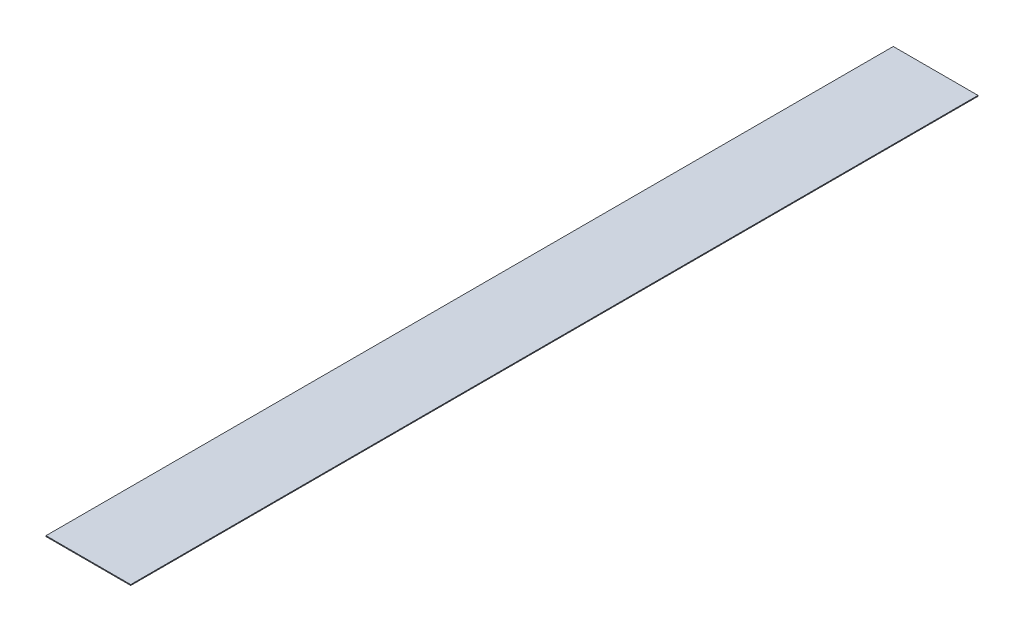
from build123d import *

# Parameters (mm, degrees)
SKETCH1_W           = 1000
SKETCH1_H           = 10000
BOSS_EXTRUDE1_DEPTH = 10


with BuildPart() as part:
    # Sketch1 → Boss-Extrude1 (new body)
    with BuildSketch(Plane(origin=(0, 0, 0), x_dir=(1, 0, 0), z_dir=(0, 1, 0))):
        with Locations((500, 5000)):
            Rectangle(SKETCH1_W, SKETCH1_H)
    extrude(amount=BOSS_EXTRUDE1_DEPTH)


solid = part.part
